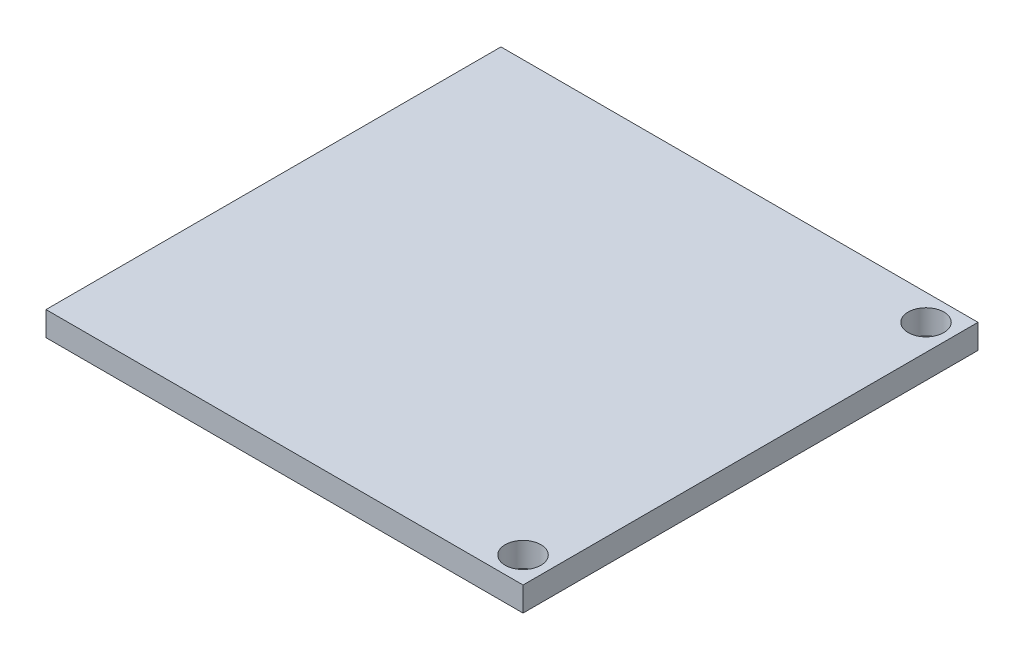
from build123d import *

# Parameters (mm, degrees)
SKETCH1_W           = 29.36
SKETCH1_H           = 28
SKETCH1_R           = 1.1
BOSS_EXTRUDE1_DEPTH = 1.5


with BuildPart() as part:
    # Sketch1 → Boss-Extrude1 (new body)
    with BuildSketch(Plane(origin=(0, 0, 0), x_dir=(1, 0, 0), z_dir=(0, 1, 0))):
        Rectangle(SKETCH1_W, SKETCH1_H)
        with Locations(Location((13.08, 12.4, 0), (0, 0, 270))):
            Circle(SKETCH1_R, mode=Mode.SUBTRACT)
        with Locations(Location((13.08, -12.4, 0), (0, 0, 270))):
            Circle(SKETCH1_R, mode=Mode.SUBTRACT)
    extrude(amount=BOSS_EXTRUDE1_DEPTH)


solid = part.part
